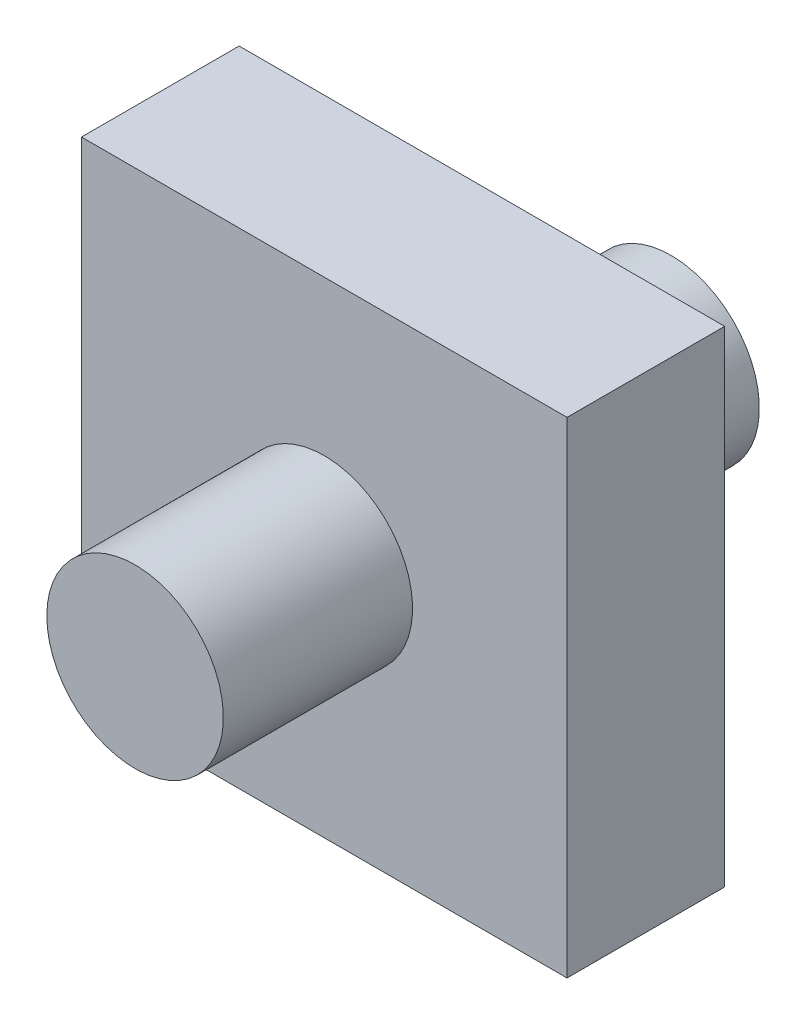
from build123d import *

# Parameters (mm, degrees)
CROQUIS1_W              = 7.7
CROQUIS1_H              = 7.7
SALIENTE_EXTRUIR1_DEPTH = 2.5
CROQUIS2_R              = 1.4
SALIENTE_EXTRUIR2_DEPTH = 3
CROQUIS6_R              = 0.6
CORTAR_EXTRUIR1_DEPTH   = 8.739186004


with BuildPart() as part:
    # Croquis1 → Saliente-Extruir1 (new body)
    with BuildSketch(Plane.XY):
        Rectangle(CROQUIS1_W, CROQUIS1_H)
    extrude(amount=SALIENTE_EXTRUIR1_DEPTH)

    # Croquis2 → Saliente-Extruir2 (add)
    with BuildSketch(Plane(origin=(0, 0, 0), x_dir=(-1, 0, 0), z_dir=(0, 0, -1))):
        Circle(CROQUIS2_R)
    saliente_extruir2 = extrude(amount=SALIENTE_EXTRUIR2_DEPTH)

    # Croquis6 → Cortar-Extruir1 (cut, through all)
    with BuildSketch(Plane(origin=(0, 0, -3), x_dir=(-1, 0, 0), z_dir=(0, 0, -1))):
        Circle(CROQUIS6_R)
    extrude(amount=-CORTAR_EXTRUIR1_DEPTH, mode=Mode.SUBTRACT)

    # Simetría3: Saliente-Extruir2 across plane
    add(saliente_extruir2.mirror(Plane(origin=(0, 0, 1.25), x_dir=(1, 0, 0), z_dir=(0, 0, -1))))


solid = part.part
